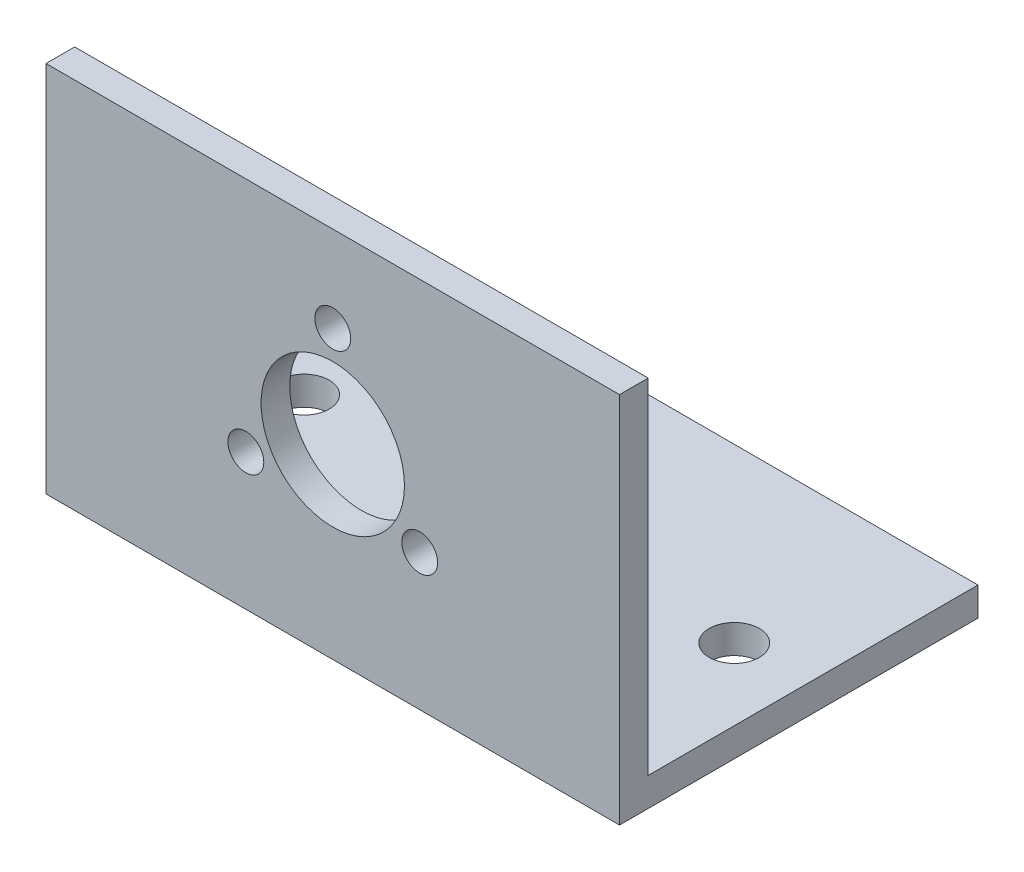
from build123d import *

# Parameters (mm, degrees)
SKETCH1_W           = 40
SKETCH1_H           = 25
BOSS_EXTRUDE1_DEPTH = 2
SKETCH2_W           = 40
SKETCH2_H           = 2
BOSS_EXTRUDE2_DEPTH = 24
SKETCH3_R           = 1.75
CUT_EXTRUDE1_DEPTH  = 36.103418637
SKETCH5_R           = 5
CUT_EXTRUDE2_DEPTH  = 42.243181255
SKETCH6_R           = 1.25
CUT_EXTRUDE3_DEPTH  = 42.243181255
CIRPATTERN1_COUNT   = 3


with BuildPart() as part:
    # Sketch1 → Boss-Extrude1 (new body)
    with BuildSketch(Plane(origin=(0, 0, 0), x_dir=(1, 0, 0), z_dir=(0, 1, 0))):
        Rectangle(SKETCH1_W, SKETCH1_H)
    extrude(amount=BOSS_EXTRUDE1_DEPTH)

    # Sketch2 → Boss-Extrude2 (add)
    with BuildSketch(Plane(origin=(0, 2, 0), x_dir=(1, 0, 0), z_dir=(0, 1, 0))):
        with Locations((0, -11.5)):
            Rectangle(SKETCH2_W, SKETCH2_H)
    extrude(amount=BOSS_EXTRUDE2_DEPTH)

    # Sketch3 → Cut-Extrude1 (cut, through all)
    with BuildSketch(Plane.XZ):
        with Locations(Location((-15, -0.5, 0), (0, 0, 270))):
            Circle(SKETCH3_R)
        with Locations(Location((15, -0.5, 0), (0, 0, 270))):
            Circle(SKETCH3_R)
    extrude(amount=-CUT_EXTRUDE1_DEPTH, mode=Mode.SUBTRACT)

    # Sketch5 → Cut-Extrude2 (cut, through all)
    with BuildSketch(Plane.XY.offset(12.5)):
        with Locations((0, 13)):
            Circle(SKETCH5_R)
    extrude(amount=-CUT_EXTRUDE2_DEPTH, mode=Mode.SUBTRACT)

    # Sketch6 → Cut-Extrude3 (cut, through all)
    with BuildSketch(Plane.XY.offset(12.5)):
        with Locations((0, 20)):
            Circle(SKETCH6_R)
    cut_extrude3 = extrude(amount=-CUT_EXTRUDE3_DEPTH, mode=Mode.SUBTRACT)

    # CirPattern1: Cut-Extrude3 ×3 about axis
    cirpattern1_axis = Axis((0, 13, 0), (0, 0, 1))
    for i in range(1, CIRPATTERN1_COUNT):
        add(cut_extrude3.rotate(cirpattern1_axis, i * 360 / CIRPATTERN1_COUNT), mode=Mode.SUBTRACT)


solid = part.part
